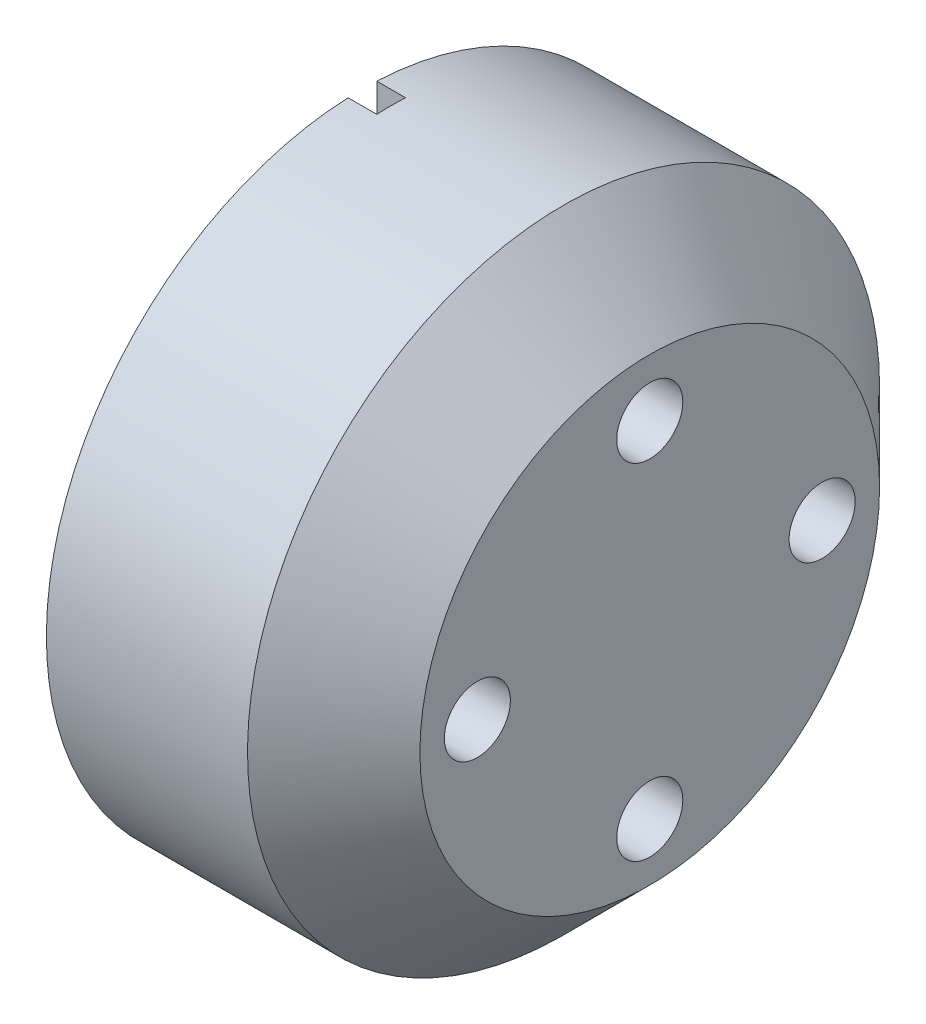
from build123d import *

# Parameters (mm, degrees)
SKETCH2_R           = 11
SKETCH2_R_2         = 1.15
BOSS_EXTRUDE1_DEPTH = 10
CHAMFER1_SIZE       = 3
SKETCH5_R           = 2
CUT_EXTRUDE2_DEPTH  = 4.5
SKETCH6_R           = 2
CUT_EXTRUDE3_DEPTH  = 8
CHAMFER2_SIZE       = 0.3
CHAMFER2_SIZE2      = 1.2
SKETCH7_W           = 1
SKETCH7_H           = 3.829479263
CUT_EXTRUDE4_DEPTH  = 1


with BuildPart() as part:
    # Sketch2 → Boss-Extrude1 (new body)
    with BuildSketch(Plane(origin=(0, 0, 0), x_dir=(0, 0, -1), z_dir=(1, 0, 0))):
        Circle(SKETCH2_R)
        with Locations((0, 6)):
            Circle(SKETCH2_R_2, mode=Mode.SUBTRACT)
        with Locations((-6, 0)):
            Circle(SKETCH2_R_2, mode=Mode.SUBTRACT)
        with Locations((0, -6)):
            Circle(SKETCH2_R_2, mode=Mode.SUBTRACT)
        with Locations((6, 0)):
            Circle(SKETCH2_R_2, mode=Mode.SUBTRACT)
    extrude(amount=BOSS_EXTRUDE1_DEPTH)

    # Chamfer1
    chamfer1_edges = [part.edges().sort_by_distance(p)[0] for p in [
        (10, 0, 11),
    ]]
    chamfer(chamfer1_edges, length=CHAMFER1_SIZE)

    # Sketch5 → Cut-Extrude2 (cut)
    with BuildSketch(Plane.ZY):
        with Locations((-6, 0)):
            Circle(SKETCH5_R)
        with Locations((0, 6)):
            Circle(SKETCH5_R)
        with Locations((0, -6)):
            Circle(SKETCH5_R)
        with Locations((6, 0)):
            Circle(SKETCH5_R)
    extrude(amount=-CUT_EXTRUDE2_DEPTH, mode=Mode.SUBTRACT)

    # Sketch6 → Cut-Extrude3 (cut)
    with BuildSketch(Plane.ZY):
        with Locations((5.303300859, 5.303300859)):
            Circle(SKETCH6_R)
        with Locations((-5.303300859, 5.303300859)):
            Circle(SKETCH6_R)
        with Locations((-5.303300859, -5.303300859)):
            Circle(SKETCH6_R)
        with Locations((5.303300859, -5.303300859)):
            Circle(SKETCH6_R)
    extrude(amount=-CUT_EXTRUDE3_DEPTH, mode=Mode.SUBTRACT)

    # Chamfer2
    chamfer2_edges = [part.edges().sort_by_distance(p)[0] for p in [
        (0, -5.303300859, 3.303300859),
        (0, -5.303300859, -7.303300859),
        (0, 5.303300859, -7.303300859),
        (0, 5.303300859, 3.303300859),
    ]]
    chamfer2_side = [part.faces().sort_by_distance(p)[0] for p in [
        (0, 0, 0),
    ]]
    chamfer(chamfer2_edges, length=CHAMFER2_SIZE, length2=CHAMFER2_SIZE2, reference=chamfer2_side[0])

    # Sketch7 → Cut-Extrude4 (cut)
    with BuildSketch(Plane.ZY):
        with Locations((0, 11.414739632)):
            Rectangle(SKETCH7_W, SKETCH7_H)
    extrude(amount=-CUT_EXTRUDE4_DEPTH, mode=Mode.SUBTRACT)


solid = part.part
